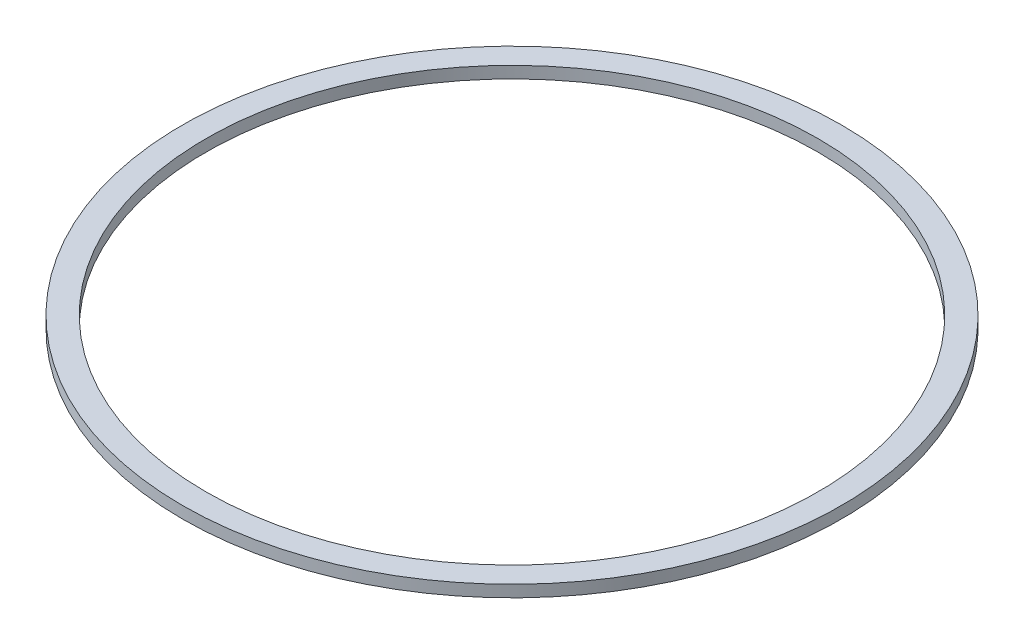
from build123d import *

# Parameters (mm, degrees)
SHIM_BLANK_SKETCH_R = 14
SHIM_BLANK_DEPTH    = 0.5
SHIM_BORE_SKETCH_R  = 13
SHIM_BORE_DEPTH     = 0.7


with BuildPart() as part:
    # Shim blank sketch → Shim blank (new body)
    with BuildSketch(Plane(origin=(0, -237.5, 0), x_dir=(1, 0, 0), z_dir=(0, 1, 0))):
        with Locations(Location((-19.009182883, 53.244882879, 0), (0, 0, 270))):
            Circle(SHIM_BLANK_SKETCH_R)
    extrude(amount=SHIM_BLANK_DEPTH)

    # Shim bore sketch → Shim bore (cut)
    with BuildSketch(Plane(origin=(0, -237.6, 0), x_dir=(1, 0, 0), z_dir=(0, 1, 0))):
        with Locations(Location((-19.009182883, 53.244882879, 0), (0, 0, 270))):
            Circle(SHIM_BORE_SKETCH_R)
    extrude(amount=SHIM_BORE_DEPTH, mode=Mode.SUBTRACT)


solid = part.part
